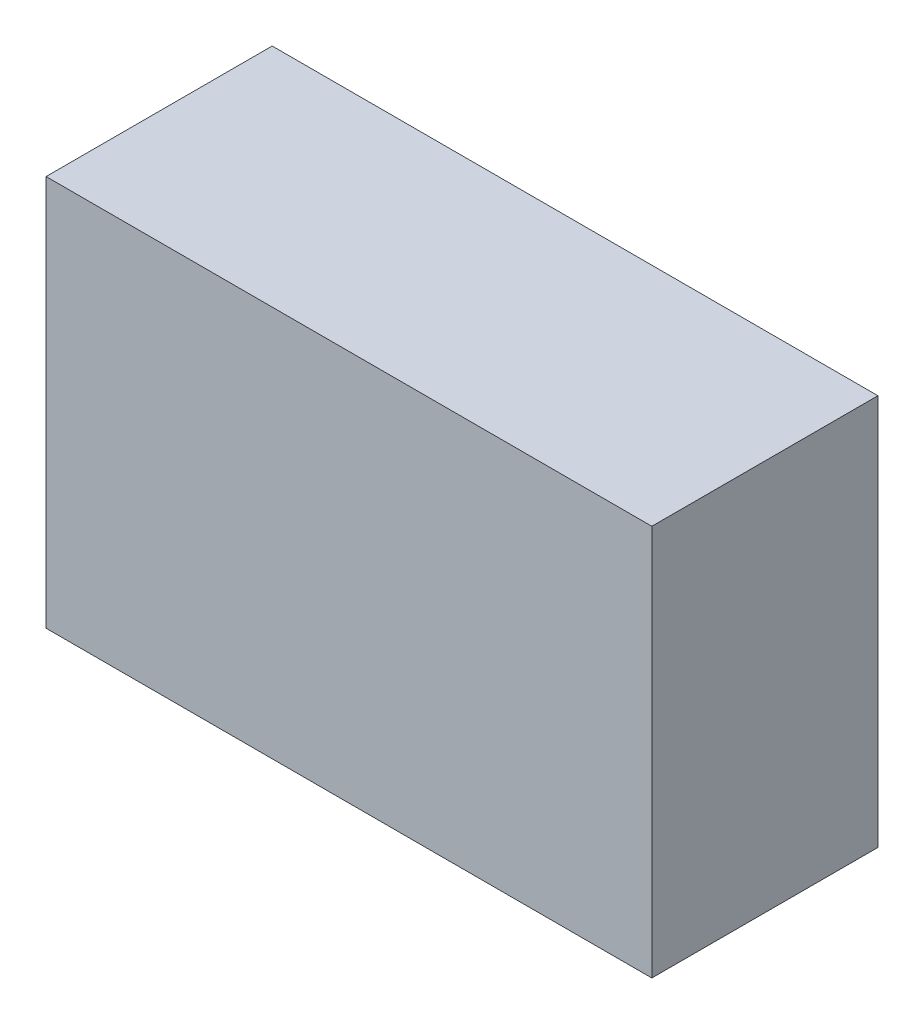
from build123d import *

# Parameters (mm, degrees)
SKETCH2_W           = 288
SKETCH2_H           = 186
BOSS_EXTRUDE1_DEPTH = 107.5


with BuildPart() as part:
    # Sketch2 → Boss-Extrude1 (new body)
    with BuildSketch(Plane.XY):
        with Locations((144, 93)):
            Rectangle(SKETCH2_W, SKETCH2_H)
    extrude(amount=BOSS_EXTRUDE1_DEPTH)


solid = part.part
